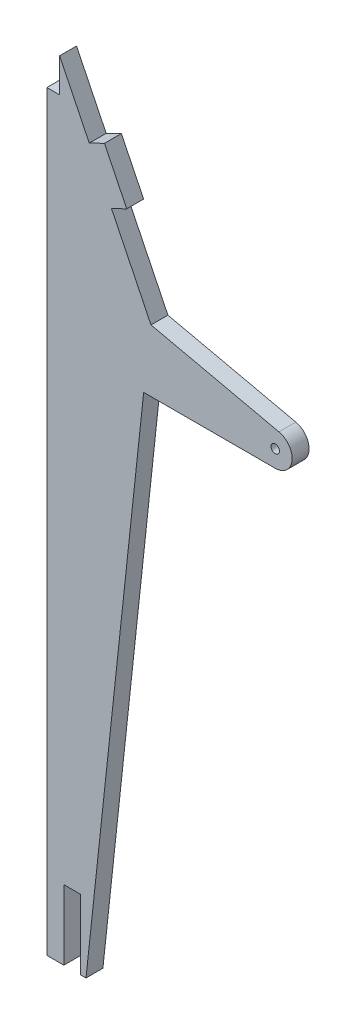
from build123d import *

# Parameters (mm, degrees)
SKETCH_1_R      = 0.5
EXTRUDE_1_DEPTH = 2


with BuildPart() as part:
    # 草图1 → 凸台-拉伸1 (new body)
    with BuildSketch(Plane.XY):
        with BuildLine():
            Line((15.072355278, 90.9902121), (11.565386103, 98.180564471))
            Line((11.565386103, 98.180564471), (11.565386103, 94.180564471))
            Line((11.565386103, 94.180564471), (10.065386103, 94.180564471))
            Line((10.065386103, 94.180564471), (10.065386103, 5.297847711))
            Line((10.065386103, 5.297847711), (12.065386103, 5.297847711))
            Line((12.065386103, 5.297847711), (12.065386103, 13.547847711))
            Line((12.065386103, 13.547847711), (14.065386103, 13.547847711))
            Line((14.065386103, 13.547847711), (14.065386103, 5.297847711))
            Line((14.065386103, 5.297847711), (14.686363295, 5.297847711))
            Line((14.686363295, 5.297847711), (21.506195844, 68.680564471))
            Line((21.506195844, 68.680564471), (37.065386103, 68.680564471))
            ThreePointArc((37.065386103, 68.680564471), (39.053255495, 70.460620657), (37.502605679, 72.632189189))
            Line((37.502605679, 72.632189189), (22.373010944, 76.021649743))
            Line((22.373010944, 76.021649743), (21.07399479, 78.685027553))
            Line((21.07399479, 78.685027553), (17.702582158, 85.597447823))
            Line((17.702582158, 85.597447823), (19.500170251, 86.474190116))
            Line((19.500170251, 86.474190116), (16.86994337, 91.866954394))
            Line((16.86994337, 91.866954394), (15.072355278, 90.9902121))
        make_face()
        with Locations((37.065386103, 70.680564471)):
            Circle(SKETCH_1_R, mode=Mode.SUBTRACT)
    extrude(amount=EXTRUDE_1_DEPTH)


solid = part.part
